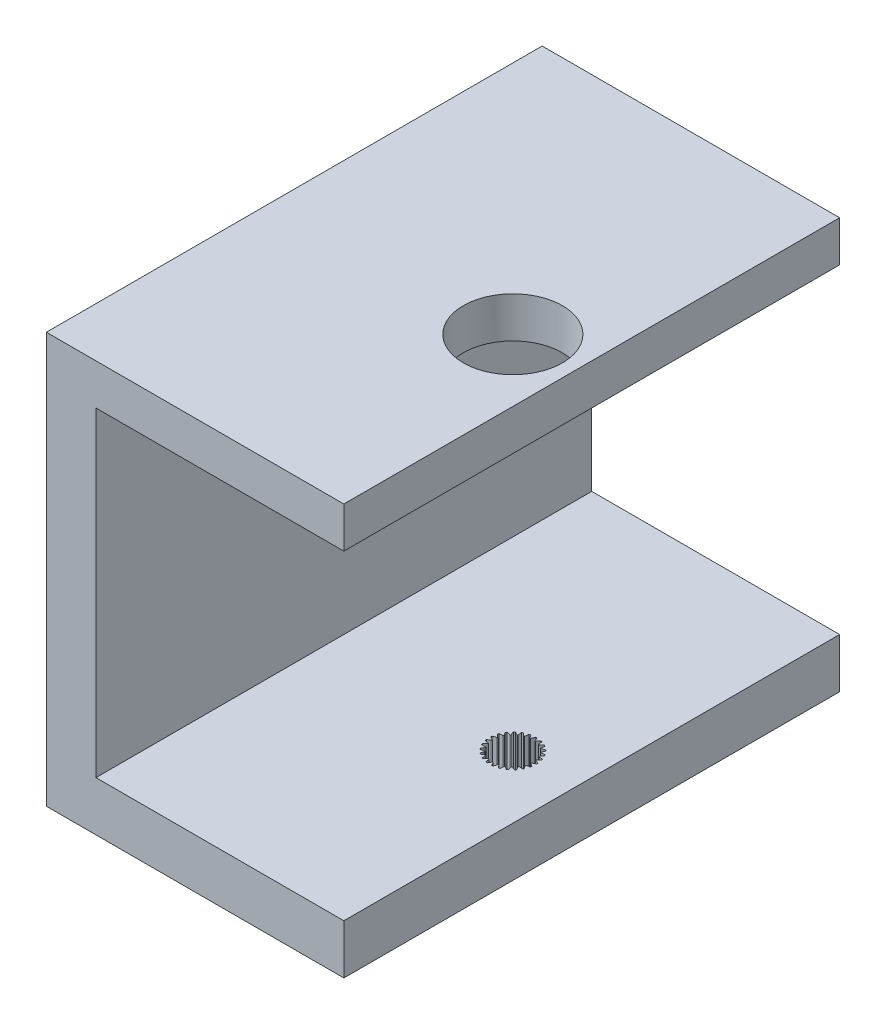
from build123d import *

# Parameters (mm, degrees)
BOSS_EXTRUDE2_DEPTH = 63.5
SKETCH2_W           = 44.45
SKETCH2_H           = 63.5
CUT_EXTRUDE1_DEPTH  = 63.5
SKETCH4_R           = 6.35
CUT_EXTRUDE2_DEPTH  = 63.5
BOSS_EXTRUDE3_START = -6.35
SKETCH6_R           = 6.35
BOSS_EXTRUDE3_DEPTH = 6.35
CUT_EXTRUDE3_DEPTH  = 6.35


with BuildPart() as part:
    # Sketch1 → Boss-Extrude2 (new body)
    with BuildSketch(Plane.XY):
        Polygon((-37.15, -39.05), (-37.15, 7.178), (-37.15, 13.528), (45.4, 13.528), (45.4, 8.3), (20, 8.3), (-30.8, 8.3), (-30.8, -32.7), (20, -32.7), (45.4, -32.7), (45.4, -39.05), (-30.8, -39.05), align=None)
    extrude(amount=BOSS_EXTRUDE2_DEPTH)

    # Sketch2 → Cut-Extrude1 (cut)
    with BuildSketch(Plane(origin=(0, 13.528, 0), x_dir=(1, 0, 0), z_dir=(0, 1, 0))):
        with Locations((23.175, -31.75)):
            Rectangle(SKETCH2_W, SKETCH2_H)
    extrude(amount=-CUT_EXTRUDE1_DEPTH, mode=Mode.SUBTRACT)

    # Sketch4 → Cut-Extrude2 (cut)
    with BuildSketch(Plane(origin=(0, 13.528, 0), x_dir=(1, 0, 0), z_dir=(0, 1, 0))):
        with Locations(Location((-7.05, -33.85, 0), (0, 0, 270))):
            Circle(SKETCH4_R)
    extrude(amount=-CUT_EXTRUDE2_DEPTH, mode=Mode.SUBTRACT)

    # Sketch6 → Boss-Extrude3 (add)
    with BuildSketch(Plane.XZ.offset(39.05).offset(BOSS_EXTRUDE3_START)):
        with Locations(Location((-7.05, 33.85, 0), (0, 0, 90))):
            Circle(SKETCH6_R)
    extrude(amount=BOSS_EXTRUDE3_DEPTH)

    # Sketch5 → Cut-Extrude3 (cut)
    with BuildSketch(Plane(origin=(0, -32.7, 0), x_dir=(1, 0, 0), z_dir=(0, 1, 0))):
        with BuildLine():
            Line((-7.118652416, -30.849791462), (-7.327177467, -31.323026463))
            ThreePointArc((-7.327177467, -31.323026463), (-7.390280692, -31.314010959), (-7.438343623, -31.272139119))
            add(Edge.make_bspline(
                [(-7.682647707, -30.913757202), (-7.552005023, -31.093536757), (-7.438343623, -31.272139119)],
                knots=[0, 0, 0, 1, 1, 1], degree=2))
            Line((-7.682647707, -30.913757202), (-7.858455511, -30.95618059))
            Line((-7.858455511, -30.95618059), (-7.942740605, -31.466406114))
            ThreePointArc((-7.942740605, -31.466406114), (-8.006103391, -31.473366982), (-8.06306944, -31.444763388))
            add(Edge.make_bspline(
                [(-8.38882422, -31.158396654), (-8.227048296, -31.310865471), (-8.06306944, -31.444763388)],
                knots=[0, 0, 0, 1, 1, 1], degree=2))
            Line((-8.38882422, -31.158396654), (-8.548558432, -31.243208856))
            Line((-8.548558432, -31.243208856), (-8.503307627, -31.758365557))
            ThreePointArc((-8.503307627, -31.758365557), (-8.562948656, -31.780865421), (-8.625238437, -31.767327342))
            add(Edge.make_bspline(
                [(-9.011975543, -31.570969264), (-8.817364654, -31.678415957), (-8.625238437, -31.767327342)],
                knots=[0, 0, 0, 1, 1, 1], degree=2))
            Line((-9.011975543, -31.570969264), (-9.145599473, -31.692841218))
            Line((-9.145599473, -31.692841218), (-8.973656043, -32.180559907))
            ThreePointArc((-8.973656043, -32.180559907), (-9.025827852, -32.217185017), (-9.089527467, -32.2195631))
            add(Edge.make_bspline(
                [(-9.512946784, -32.12555158), (-9.297729048, -32.181224877), (-9.089527467, -32.2195631)],
                knots=[0, 0, 0, 1, 1, 1], degree=2))
            Line((-9.512946784, -32.12555158), (-9.612064351, -32.276825622))
            Line((-9.612064351, -32.276825622), (-9.324232134, -32.706461139))
            ThreePointArc((-9.324232134, -32.706461139), (-9.365656575, -32.754910205), (-9.426763545, -32.773055027))
            add(Edge.make_bspline(
                [(-9.86026008, -32.787297153), (-9.637958419, -32.787698897), (-9.426763545, -32.773055027)],
                knots=[0, 0, 0, 1, 1, 1], degree=2))
            Line((-9.86026008, -32.787297153), (-9.918643361, -32.95846818))
            Line((-9.918643361, -32.95846818), (-9.533007914, -33.303024946))
            ThreePointArc((-9.533007914, -33.303024946), (-9.561082138, -33.360253735), (-9.615756886, -33.393025189))
            add(Edge.make_bspline(
                [(-10.032092457, -33.514626077), (-9.816674902, -33.459731025), (-9.615756886, -33.393025189)],
                knots=[0, 0, 0, 1, 1, 1], degree=2))
            Line((-10.032092457, -33.514626077), (-10.046073017, -33.694938783))
            Line((-10.046073017, -33.694938783), (-9.586865234, -33.932767029))
            ThreePointArc((-9.586865234, -33.932767029), (-9.599825233, -33.995179646), (-9.644632344, -34.040518581))
            add(Edge.make_bspline(
                [(-10.017647056, -34.2618376), (-9.822649084, -34.155095009), (-9.644632344, -34.040518581)],
                knots=[0, 0, 0, 1, 1, 1], degree=2))
            Line((-10.017647056, -34.2618376), (-9.986346445, -34.439962275))
            Line((-9.986346445, -34.439962275), (-9.482420039, -34.556118377))
            ThreePointArc((-9.482420039, -34.556118377), (-9.479451489, -34.619793207), (-9.511575568, -34.674850812))
            add(Edge.make_bspline(
                [(-9.817831535, -34.981981674), (-9.655505586, -34.830098574), (-9.511575568, -34.674850812)],
                knots=[0, 0, 0, 1, 1, 1], degree=2))
            Line((-9.817831535, -34.981981674), (-9.743216485, -35.146726089))
            Line((-9.743216485, -35.146726089), (-9.226235006, -35.133911532))
            ThreePointArc((-9.226235006, -35.133911532), (-9.207524432, -35.194847652), (-9.224947004, -35.256164455))
            add(Edge.make_bspline(
                [(-9.445201038, -35.629808998), (-9.325746648, -35.442328763), (-9.224947004, -35.256164455)],
                knots=[0, 0, 0, 1, 1, 1], degree=2))
            Line((-9.445201038, -35.629808998), (-9.331959886, -35.770821655))
            Line((-9.331959886, -35.770821655), (-8.834407182, -35.629841626))
            ThreePointArc((-8.834407182, -35.629841626), (-8.801130238, -35.684210196), (-8.80275658, -35.747933436))
            add(Edge.make_bspline(
                [(-8.923169308, -36.164614199), (-8.854092236, -35.953316901), (-8.80275658, -35.747933436)],
                knots=[0, 0, 0, 1, 1, 1], degree=2))
            Line((-8.923169308, -36.164614199), (-8.778417414, -36.273034755))
            Line((-8.778417414, -36.273034755), (-8.33155655, -36.012747547))
            ThreePointArc((-8.33155655, -36.012747547), (-8.285804149, -36.057132388), (-8.271532071, -36.1192581))
            add(Edge.make_bspline(
                [(-8.284537521, -36.552793499), (-8.270178133, -36.330955726), (-8.271532071, -36.1192581)],
                knots=[0, 0, 0, 1, 1, 1], degree=2))
            Line((-8.284537521, -36.552793499), (-8.117370177, -36.621809492))
            Line((-8.117370177, -36.621809492), (-7.749279065, -36.258569907))
            ThreePointArc((-7.749279065, -36.258569907), (-7.693926, -36.290182158), (-7.664652269, -36.346806755))
            add(Edge.make_bspline(
                [(-7.569433258, -36.769956166), (-7.610693808, -36.551516799), (-7.664652269, -36.346806755)],
                knots=[0, 0, 0, 1, 1, 1], degree=2))
            Line((-7.569433258, -36.769956166), (-7.390354205, -36.795231067))
            Line((-7.390354205, -36.795231067), (-7.124161364, -36.351862784))
            ThreePointArc((-7.124161364, -36.351862784), (-7.062685669, -36.36871613), (-7.020249662, -36.41628168))
            add(Edge.make_bspline(
                [(-6.822789153, -36.802457069), (-6.917077087, -36.601141459), (-7.020249662, -36.41628168)],
                knots=[0, 0, 0, 1, 1, 1], degree=2))
            Line((-6.822789153, -36.802457069), (-6.643050585, -36.782402764))
            Line((-6.643050585, -36.782402764), (-6.495481889, -36.286764243))
            ThreePointArc((-6.495481889, -36.286764243), (-6.43174631, -36.287799727), (-6.378814436, -36.323317512))
            add(Edge.make_bspline(
                [(-6.091519598, -36.648254059), (-6.232910461, -36.476711604), (-6.378814436, -36.323317512)],
                knots=[0, 0, 0, 1, 1, 1], degree=2))
            Line((-6.091519598, -36.648254059), (-5.922415151, -36.584130632))
            Line((-5.922415151, -36.584130632), (-5.902742885, -36.067364665))
            ThreePointArc((-5.902742885, -36.067364665), (-5.840752162, -36.052517223), (-5.780650327, -36.07375553))
            add(Edge.make_bspline(
                [(-5.421572951, -36.317036277), (-5.601182633, -36.186045621), (-5.780650327, -36.07375553)],
                knots=[0, 0, 0, 1, 1, 1], degree=2))
            Line((-5.421572951, -36.317036277), (-5.273728079, -36.212872839))
            Line((-5.273728079, -36.212872839), (-5.383188323, -35.707449732))
            ThreePointArc((-5.383188323, -35.707449732), (-5.326837562, -35.677652283), (-5.263342184, -35.683276631))
            add(Edge.make_bspline(
                [(-4.855044422, -35.829615354), (-5.061587388, -35.747407123), (-5.263342184, -35.683276631)],
                knots=[0, 0, 0, 1, 1, 1], degree=2))
            Line((-4.855044422, -35.829615354), (-4.737748763, -35.691956878))
            Line((-4.737748763, -35.691956878), (-4.969463728, -35.229634223))
            ThreePointArc((-4.969463728, -35.229634223), (-4.922293653, -35.186759051), (-4.85939438, -35.176416042))
            add(Edge.make_bspline(
                [(-4.427531084, -35.21661774), (-4.648029478, -35.188357378), (-4.85939438, -35.176416042)],
                knots=[0, 0, 0, 1, 1, 1], degree=2))
            Line((-4.427531084, -35.21661774), (-4.348154754, -35.054113814))
            Line((-4.348154754, -35.054113814), (-4.687564936, -34.663941044))
            ThreePointArc((-4.687564936, -34.663941044), (-4.652539417, -34.610682154), (-4.594188443, -34.585021676))
            add(Edge.make_bspline(
                [(-4.16589517, -34.51656033), (-4.386494268, -34.54402354), (-4.594188443, -34.585021676)],
                knots=[0, 0, 0, 1, 1, 1], degree=2))
            Line((-4.16589517, -34.51656033), (-4.129425676, -34.339421673))
            Line((-4.129425676, -34.339421673), (-4.555204686, -34.045914777))
            ThreePointArc((-4.555204686, -34.045914777), (-4.534524505, -33.985618621), (-4.484388236, -33.946253017))
            add(Edge.make_bspline(
                [(-4.086576228, -33.773430304), (-4.293414977, -33.854891472), (-4.484388236, -33.946253017)],
                knots=[0, 0, 0, 1, 1, 1], degree=2))
            Line((-4.086576228, -33.773430304), (-4.095305083, -33.592787189))
            Line((-4.095305083, -33.592787189), (-4.580699659, -33.414388287))
            ThreePointArc((-4.580699659, -33.414388287), (-4.575664229, -33.350843493), (-4.53689291, -33.300246249))
            add(Edge.make_bspline(
                [(-4.194558159, -33.033921256), (-4.374640119, -33.164261876), (-4.53689291, -33.300246249)],
                knots=[0, 0, 0, 1, 1, 1], degree=2))
            Line((-4.194558159, -33.033921256), (-4.247936897, -32.861124155))
            Line((-4.247936897, -32.861124155), (-4.762447912, -32.809042704))
            ThreePointArc((-4.762447912, -32.809042704), (-4.773373627, -32.746242027), (-4.748403403, -32.687592353))
            add(Edge.make_bspline(
                [(-4.48305606, -32.344499259), (-4.625066021, -32.515529551), (-4.748403403, -32.687592353)],
                knots=[0, 0, 0, 1, 1, 1], degree=2))
            Line((-4.48305606, -32.344499259), (-4.577730699, -32.190405649))
            Line((-4.577730699, -32.190405649), (-5.089029535, -32.267914119))
            ThreePointArc((-5.089029535, -32.267914119), (-5.115229891, -32.209803555), (-5.105629734, -32.146786627))
            add(Edge.make_bspline(
                [(-4.933942548, -31.748483232), (-5.028957501, -31.949456735), (-5.105629734, -32.146786627)],
                knots=[0, 0, 0, 1, 1, 1], degree=2))
            Line((-4.933942548, -31.748483232), (-5.063964331, -31.622775381))
            Line((-5.063964331, -31.622775381), (-5.539924202, -31.82500363))
            ThreePointArc((-5.539924202, -31.82500363), (-5.579752935, -31.77523448), (-5.586126058, -31.711809882))
            add(Edge.make_bspline(
                [(-5.518886767, -31.283323055), (-5.560936572, -31.501611863), (-5.586126058, -31.711809882)],
                knots=[0, 0, 0, 1, 1, 1], degree=2))
            Line((-5.518886767, -31.283323055), (-5.676085948, -31.19389965))
            Line((-5.676085948, -31.19389965), (-6.086800543, -31.508140933))
            ThreePointArc((-6.086800543, -31.508140933), (-6.137755068, -31.469840375), (-6.159701023, -31.409993309))
            add(Edge.make_bspline(
                [(-6.201134519, -30.978246451), (-6.187577033, -31.200134676), (-6.159701023, -31.409993309)],
                knots=[0, 0, 0, 1, 1, 1], degree=2))
            Line((-6.201134519, -30.978246451), (-6.375633695, -30.930726293))
            Line((-6.375633695, -30.930726293), (-6.695296307, -31.337235675))
            ThreePointArc((-6.695296307, -31.337235675), (-6.754174963, -31.312810275), (-6.790314806, -31.260301151))
            add(Edge.make_bspline(
                [(-6.93781767, -30.852422507), (-6.86950476, -31.063968096), (-6.790314806, -31.260301151)],
                knots=[0, 0, 0, 1, 1, 1], degree=2))
            Line((-6.93781767, -30.852422507), (-7.118652416, -30.849791462))
        make_face()
    extrude(amount=-CUT_EXTRUDE3_DEPTH, mode=Mode.SUBTRACT)


solid = part.part
